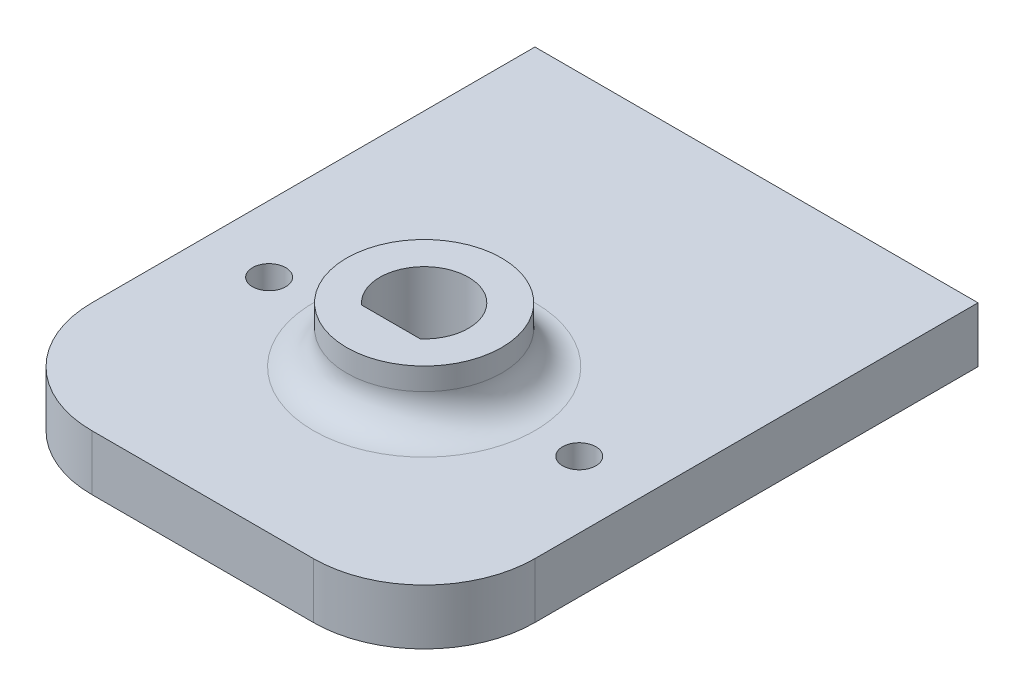
from build123d import *

# Parameters (mm, degrees)
SKETCH1_R           = 1.5
BOSS_EXTRUDE1_DEPTH = 5
SKETCH2_R           = 7
BOSS_EXTRUDE2_DEPTH = 5
FILLET1_R           = 10
FILLET2_R           = 3


with BuildPart() as part:
    # Sketch1 → Boss-Extrude1 (new body)
    with BuildSketch(Plane(origin=(0, 0, 0), x_dir=(1, 0, 0), z_dir=(0, 1, 0))):
        Polygon((-20, 20), (-20, -20), (20, -20), (20, 20), (20, 30), (-20, 30), align=None)
        with Locations(Location((14, 0, 0), (0, 0, 270))):
            Circle(SKETCH1_R, mode=Mode.SUBTRACT)
        with Locations(Location((-14, 0, 0), (0, 0, 270))):
            Circle(SKETCH1_R, mode=Mode.SUBTRACT)
        with BuildLine():
            Line((-2.645751311, -3), (2.645751311, -3))
            ThreePointArc((2.645751311, -3), (0, 4), (-2.645751311, -3))
        make_face(mode=Mode.SUBTRACT)
    extrude(amount=BOSS_EXTRUDE1_DEPTH)

    # Sketch2 → Boss-Extrude2 (add)
    with BuildSketch(Plane(origin=(0, 5, 0), x_dir=(1, 0, 0), z_dir=(0, 1, 0))):
        with Locations(Location((0, 0, 0), (0, 0, 270))):
            Circle(SKETCH2_R)
        with BuildLine():
            ThreePointArc((-2.645751311, -3), (0, 4), (2.645751311, -3))
            Line((2.645751311, -3), (-2.645751311, -3))
        make_face(mode=Mode.SUBTRACT)
    extrude(amount=BOSS_EXTRUDE2_DEPTH)

    # Fillet1
    fillet1_edges = [part.edges().sort_by_distance(p)[0] for p in [
        (20, 2.5, 20),
        (-20, 2.5, 20),
    ]]
    fillet(fillet1_edges, radius=FILLET1_R)

    # Fillet2
    fillet2_edges = [part.edges().sort_by_distance(p)[0] for p in [
        (0, 5, -7),
    ]]
    fillet(fillet2_edges, radius=FILLET2_R)


solid = part.part
